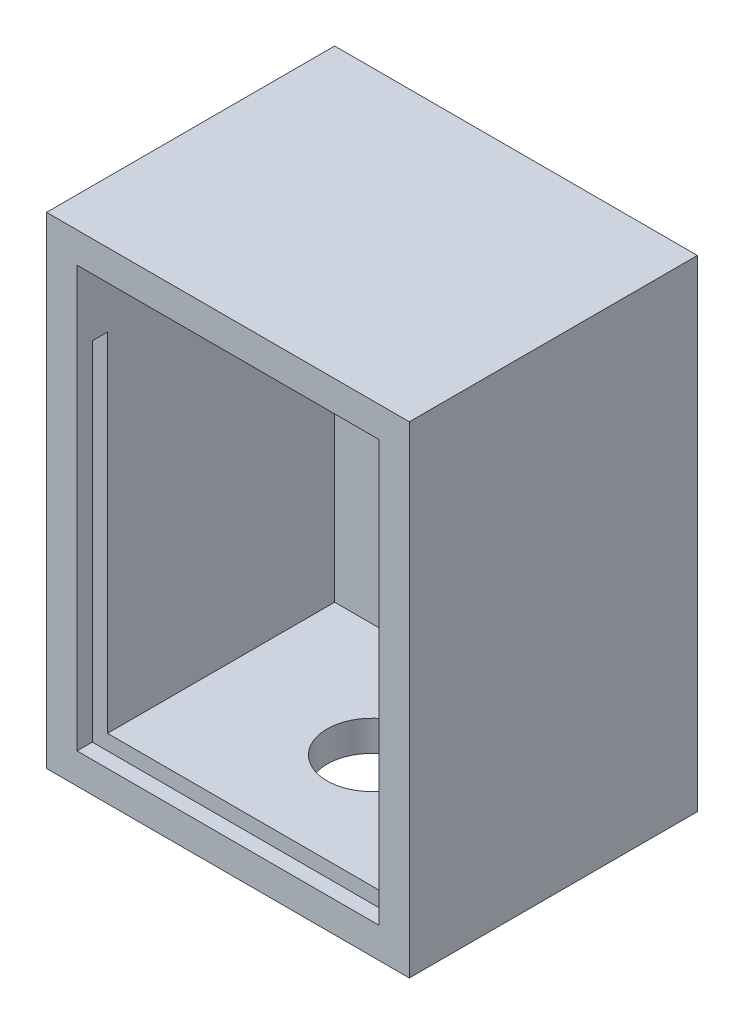
from build123d import *

# Parameters (mm, degrees)
SKETCH2_W           = 23.8
SKETCH2_H           = 18.9
BOSS_EXTRUDE1_DEPTH = 31.6
SHELL2_T            = -2
SKETCH10_W          = 21.8
SKETCH10_H          = 1
CUT_EXTRUDE5_DEPTH  = 24.8
SKETCH12_R          = 2.95
CUT_EXTRUDE6_DEPTH  = 2


with BuildPart() as part:
    # Sketch2 → Boss-Extrude1 (new body)
    with BuildSketch(Plane(origin=(-2.162079654, 0, 0), x_dir=(1, 0, 0), z_dir=(0, 1, 0))):
        with Locations((-82.717170842, -18.240014695)):
            Rectangle(SKETCH2_W, SKETCH2_H)
    extrude(amount=BOSS_EXTRUDE1_DEPTH)

    # Shell2
    shell2_openings = [part.faces().sort_by_distance(p)[0] for p in [
        (-84.879250496, 15.8, 27.690014695),
    ]]
    offset(amount=SHELL2_T, openings=shell2_openings, kind=Kind.INTERSECTION)

    # Sketch10 → Cut-Extrude5 (cut)
    with BuildSketch(Plane.XZ):
        with Locations((-84.938526567, 26.190014695)):
            Rectangle(SKETCH10_W, SKETCH10_H)
    extrude(amount=-CUT_EXTRUDE5_DEPTH, mode=Mode.SUBTRACT)

    # Sketch12 → Cut-Extrude6 (cut)
    with BuildSketch(Plane(origin=(0, 0, 0), x_dir=(-1, 0, 0), z_dir=(0, -1, 0))):
        with Locations(Location((84.879250496, -18.240014695, 0), (0, 0, 90))):
            Circle(SKETCH12_R)
    extrude(amount=-CUT_EXTRUDE6_DEPTH, mode=Mode.SUBTRACT)


solid = part.part
